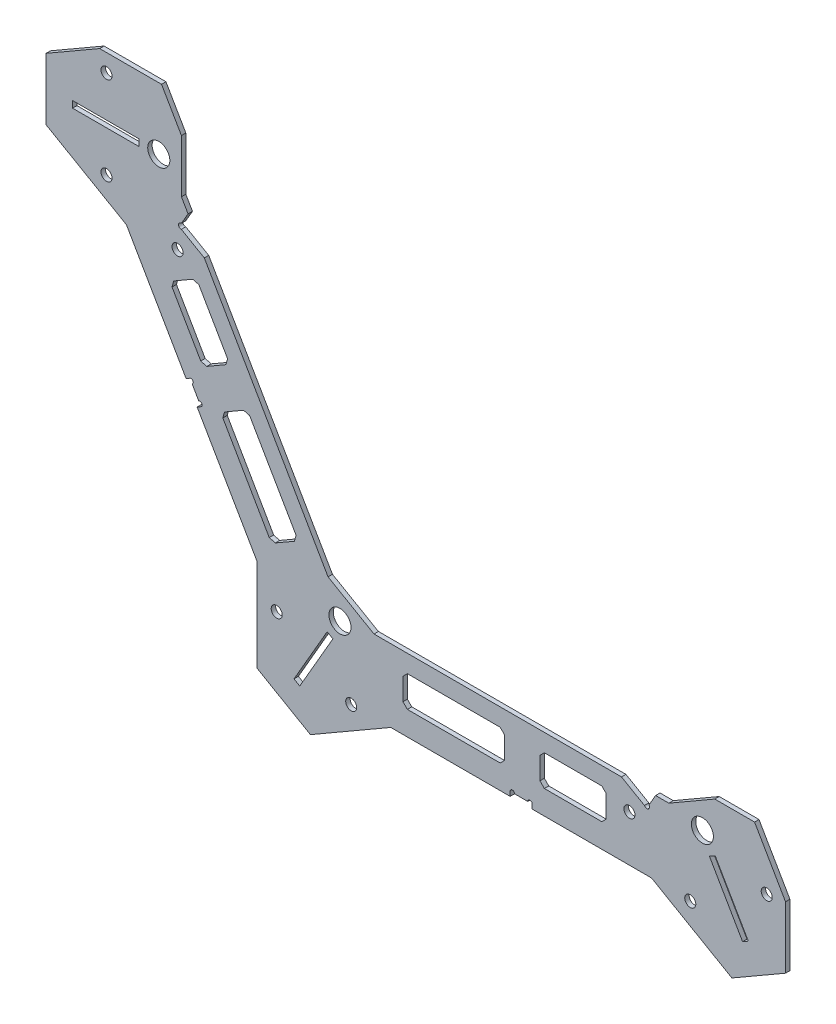
from build123d import *
from build123d.topology import SkipClean

# Parameters (mm, degrees)
CROQUIS1_R              = 1.25
CROQUIS1_R_2            = 2.5
SALIENTE_EXTRUIR1_DEPTH = 1


with BuildPart() as part:
    # Croquis1 → Saliente-Extruir1 (new body)
    with BuildSketch(Plane.XY):
        with BuildLine():
            Line((64.278746094, 29.055249422), (61.278746094, 23.859096999))
            Line((61.278746094, 23.859096999), (67.340923921, 20.359096999))
            Line((67.340923921, 20.359096999), (85.5274574, 30.859096999))
            Line((85.5274574, 30.859096999), (112.5274574, 30.859096999))
            Line((112.5274574, 30.859096999), (112.5274574, 31.859096999))
            ThreePointArc((112.5274574, 31.859096999), (113.027457314, 32.359096999), (113.527457227, 31.859096999))
            Line((113.527457227, 31.859096999), (116.527457227, 31.859096999))
            ThreePointArc((116.527457227, 31.859096999), (117.027457227, 32.359096999), (117.527457227, 31.859096999))
            Line((117.527457227, 31.859096999), (117.527457227, 30.859096999))
            Line((117.527457227, 30.859096999), (144.527457227, 30.859096999))
            Line((144.527457227, 30.859096999), (162.713990707, 20.359096999))
            Line((162.713990707, 20.359096999), (174.83834636, 27.359096999))
            Line((174.83834636, 27.359096999), (174.83834636, 41.359096999))
            Line((174.83834636, 41.359096999), (167.83834636, 53.483452652))
            Line((167.83834636, 53.483452652), (158.83834636, 53.483452652))
            Line((158.83834636, 53.483452652), (148.446041514, 47.483452652))
            Line((148.446041514, 47.483452652), (145.446041514, 47.483452652))
            Line((145.446041514, 47.483452652), (143.946041514, 44.88537644))
            ThreePointArc((143.946041514, 44.88537644), (143.77192137, 44.012873167), (142.92105094, 44.272871814))
            Line((142.92105094, 44.272871814), (137.724898517, 47.272871814))
            Line((137.724898517, 47.272871814), (81.724898517, 47.272871814))
            Line((81.724898517, 47.272871814), (76.528746094, 50.272871814))
            Line((76.528746094, 50.272871814), (75.278746094, 48.107808305))
            ThreePointArc((75.278746094, 48.107808305), (76.193809604, 44.692744795), (72.778746094, 43.777681286))
            Line((72.778746094, 43.777681286), (71.778746094, 42.045630478))
            Line((71.778746094, 42.045630478), (72.428265147, 41.670630478))
            Line((72.428265147, 41.670630478), (64.928265147, 28.680249422))
            Line((64.928265147, 28.680249422), (64.278746094, 29.055249422))
        make_face()
        with Locations((76.571886424, 30.884748108)):
            Circle(CROQUIS1_R, mode=Mode.SUBTRACT)
        with Locations((153.286799356, 30.709365751)):
            Circle(CROQUIS1_R, mode=Mode.SUBTRACT)
        Polygon((166.425687586, 29.430249422), (165.776168533, 29.055249422), (165.12664948, 28.680249422), (157.62664948, 41.670630478), (158.276168533, 42.045630478), (158.925687586, 42.420630478), align=None, mode=Mode.SUBTRACT)
        Polygon((88.277457227, 42.272871814), (89.277457227, 43.272871814), (110.277457227, 43.272871814), (111.277457227, 42.272871814), (111.277457227, 37.272871814), (110.277457227, 36.272871814), (89.277457227, 36.272871814), (88.277457227, 37.272871814), align=None, mode=Mode.SUBTRACT)
        Polygon((119.277457227, 42.272871814), (120.277457227, 43.272871814), (133.277457227, 43.272871814), (134.277457227, 42.272871814), (134.277457227, 37.272871814), (133.277457227, 36.272871814), (120.277457227, 36.272871814), (119.277457227, 37.272871814), align=None, mode=Mode.SUBTRACT)
        with Locations((139.527457227, 41.32468677)):
            Circle(CROQUIS1_R, mode=Mode.SUBTRACT)
        with Locations((170.58834636, 40.698418571)):
            Circle(CROQUIS1_R, mode=Mode.SUBTRACT)
        with Locations((156.026168533, 45.942744795)):
            Circle(CROQUIS1_R_2, mode=Mode.SUBTRACT)
    saliente_extruir1 = extrude(amount=SALIENTE_EXTRUIR1_DEPTH)

    # Simetría2: Saliente-Extruir1 across plane
    with SkipClean():  # the faces are left unmerged after this step: merging them gives an invalid solid
        add(saliente_extruir1.mirror(Plane(origin=(35.627767514, -20.569701165, 1), x_dir=(0, 0, 1), z_dir=(0.8660254037844365, -0.5000000000000039, 0))))


solid = part.part
